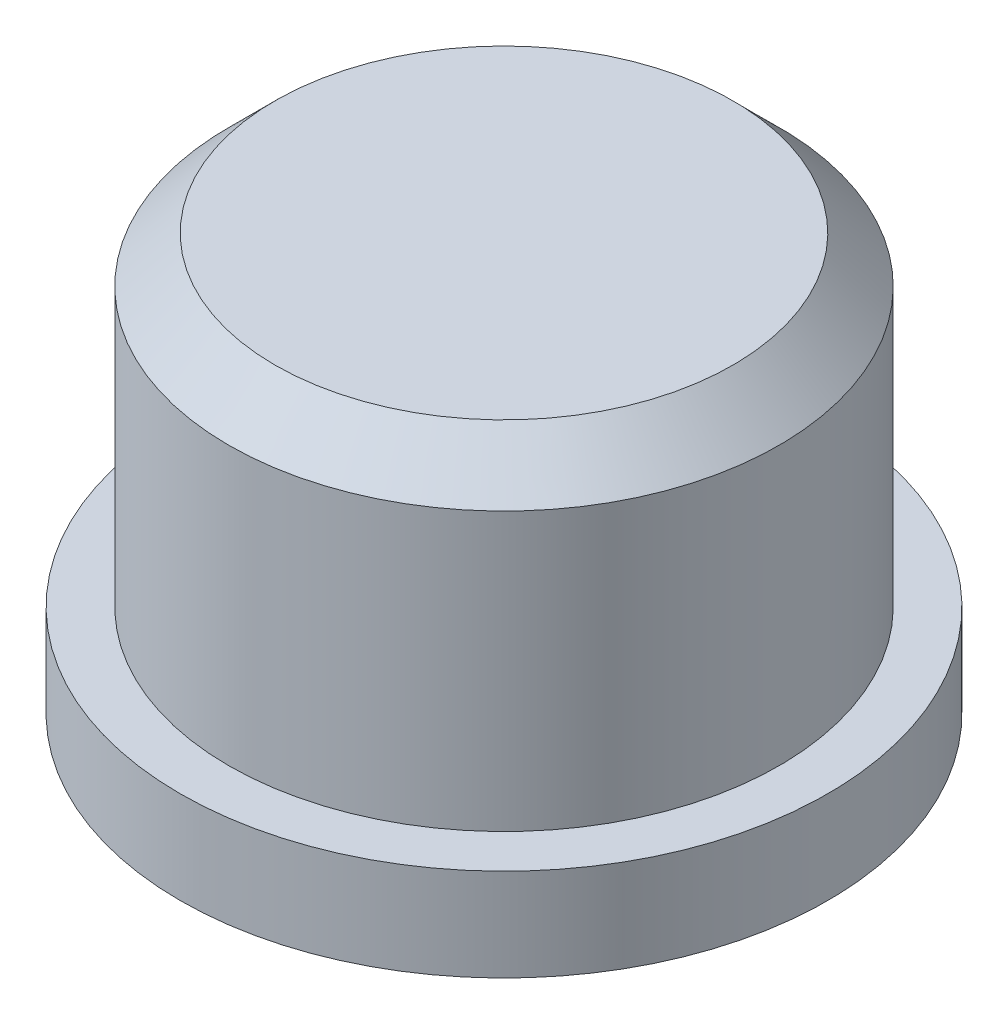
from build123d import *

# Parameters (mm, degrees)
SKETCH1_R           = 7
BOSS_EXTRUDE1_DEPTH = 2
SKETCH2_R           = 5.95
BOSS_EXTRUDE2_DEPTH = 7
SKETCH3_R           = 3.5
CUT_EXTRUDE1_DEPTH  = 1.8
CHAMFER1_SIZE       = 1


with BuildPart() as part:
    # Sketch1 → Boss-Extrude1 (new body)
    with BuildSketch(Plane(origin=(0, 0, 0), x_dir=(1, 0, 0), z_dir=(0, 1, 0))):
        with Locations(Location((0, 0, 0), (0, 0, 270))):
            Circle(SKETCH1_R)
    extrude(amount=BOSS_EXTRUDE1_DEPTH)

    # Sketch2 → Boss-Extrude2 (add)
    with BuildSketch(Plane(origin=(0, 2, 0), x_dir=(1, 0, 0), z_dir=(0, 1, 0))):
        with Locations(Location((0, 0, 0), (0, 0, 270))):
            Circle(SKETCH2_R)
    extrude(amount=BOSS_EXTRUDE2_DEPTH)

    # Sketch3 → Cut-Extrude1 (cut)
    with BuildSketch(Plane.XZ):
        with Locations(Location((0, 0, 0), (0, 0, 270))):
            Circle(SKETCH3_R)
    extrude(amount=-CUT_EXTRUDE1_DEPTH, mode=Mode.SUBTRACT)

    # Chamfer1
    chamfer1_edges = [part.edges().sort_by_distance(p)[0] for p in [
        (0, 9, -5.95),
    ]]
    chamfer(chamfer1_edges, length=CHAMFER1_SIZE)


solid = part.part
